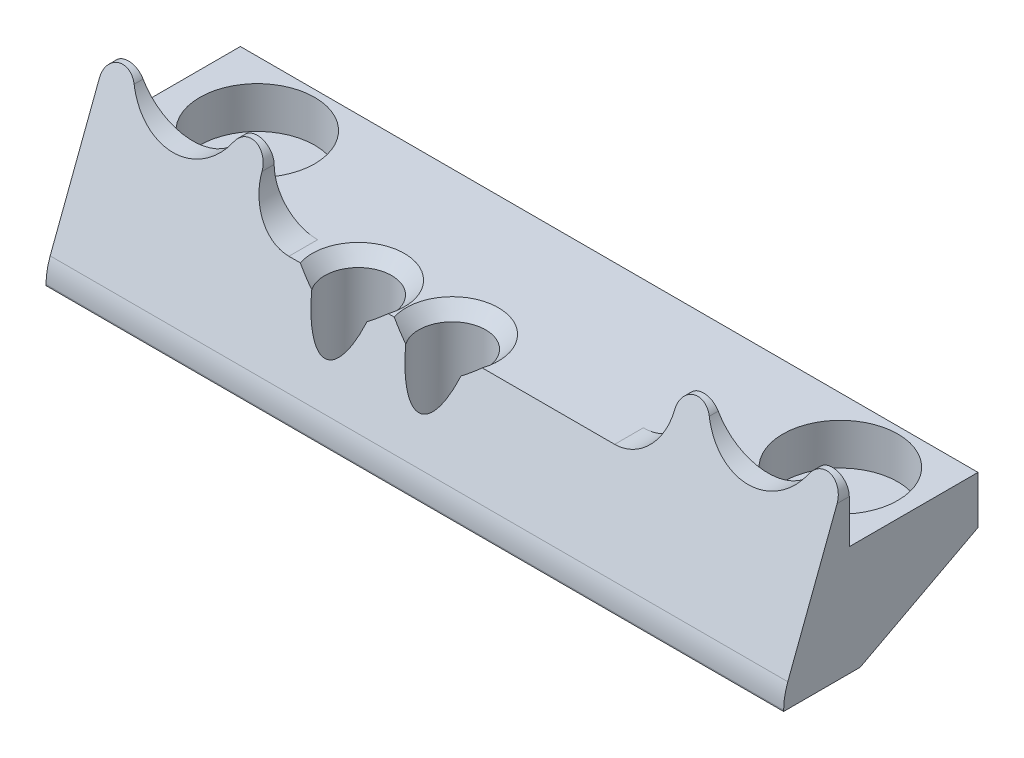
from build123d import *

# Parameters (mm, degrees)
SKETCH1_W               = 115.75
SKETCH1_H               = 30.5
SKETCH1_R               = 2.75
SKETCH1_R_2             = 9.025
BOSS_EXTRUDE1_DEPTH     = 17.25
SKETCH3_R               = 9.025
BOSS_EXTRUDE2_DEPTH     = 10.75
SKETCH4_R               = 5.25
CUT_EXTRUDE1_DEPTH      = 14.25
CUT_EXTRUDE2_DEPTH      = 120.171619944
CUT_EXTRUDE2_DEPTH_BACK = 120.171619944
BOSS_EXTRUDE4_REACH     = 67.617
CHAMFER1_SIZE           = 2


with BuildPart() as part:
    # Sketch1 → Boss-Extrude1 (new body)
    with BuildSketch(Plane(origin=(0, 0, 0), x_dir=(1, 0, 0), z_dir=(0, 1, 0))):
        with Locations((2.125, 7.25)):
            Rectangle(SKETCH1_W, SKETCH1_H)
        with Locations(Location((0, 0, 0), (0, 0, 270))):
            Circle(SKETCH1_R, mode=Mode.SUBTRACT)
        with Locations(Location((-14.75, 0, 0), (0, 0, 270))):
            Circle(SKETCH1_R, mode=Mode.SUBTRACT)
        with Locations(Location((48.5, 12.4, 0), (0, 0, 270))):
            Circle(SKETCH1_R_2, mode=Mode.SUBTRACT)
        with Locations(Location((-43, 12.4, 0), (0, 0, 270))):
            Circle(SKETCH1_R_2, mode=Mode.SUBTRACT)
    extrude(amount=BOSS_EXTRUDE1_DEPTH)

    # Sketch3 → Boss-Extrude2 (add)
    with BuildSketch(Plane.XZ):
        with Locations(Location((48.5, -12.4, 0), (0, 0, 270))):
            Circle(SKETCH3_R)
        with Locations(Location((-43, -12.4, 0), (0, 0, 270))):
            Circle(SKETCH3_R)
    extrude(amount=-BOSS_EXTRUDE2_DEPTH)

    # Sketch4 → Cut-Extrude1 (cut)
    with BuildSketch(Plane(origin=(0, 17.25, 0), x_dir=(1, 0, 0), z_dir=(0, 1, 0))):
        with Locations(Location((-14.75, 0, 0), (0, 0, 270))):
            Circle(SKETCH4_R)
        with Locations(Location((0, 0, 0), (0, 0, 270))):
            Circle(SKETCH4_R)
    extrude(amount=-CUT_EXTRUDE1_DEPTH, mode=Mode.SUBTRACT)

    # Sketch8 → Cut-Extrude2 (cut, two sides: drawn at the far end of the back side and taken through both)
    with BuildSketch(Plane(origin=(60, 0, 0), x_dir=(0, 0, -1), z_dir=(1, 0, 0)).offset(-CUT_EXTRUDE2_DEPTH_BACK)):
        with BuildLine():
            Line((-2.2, 17.25), (-7.34681784, 3.717418611))
            ThreePointArc((-7.34681784, 3.717418611), (-7.835348962, 1.969746414), (-8, 0.162563302))
            Line((-8, 0.162563302), (-8, 17.25))
            Line((-8, 17.25), (-2.2, 17.25))
        make_face()
        Polygon((22.5, 9.75), (4, 0), (22.5, 0), align=None)
    extrude(amount=CUT_EXTRUDE2_DEPTH + CUT_EXTRUDE2_DEPTH_BACK, mode=Mode.SUBTRACT)

    # Boss-Extrude4: up to this plane
    boss_extrude4_end = Plane(origin=(-55.75, 17.25, 2.2), z_dir=(0, -0.35548553095217983, -0.9346817839690934))
    # Sketch7 → Boss-Extrude4 (add, up to the surface)
    with BuildSketch(Plane.XY.offset(-2.3), mode=Mode.PRIVATE) as boss_extrude4_sk1:
        with BuildLine():
            ThreePointArc((39.434120731, 25.3875), (36.45982129, 26.619495167), (34.5, 24.065406335))
            ThreePointArc((34.5, 24.065406335), (32.503813701, 19.246186299), (27.684593665, 17.25))
            Line((27.684593665, 17.25), (60, 17.25))
            Line((60, 17.25), (60, 24.065406335))
            ThreePointArc((60, 24.065406335), (58.04017871, 26.619495167), (55.065879269, 25.3875))
            ThreePointArc((55.065879269, 25.3875), (47.25, 20.875), (39.434120731, 25.3875))
        make_face()
    boss_extrude4_tool1 = split(extrude(boss_extrude4_sk1.sketch, amount=BOSS_EXTRUDE4_REACH, mode=Mode.PRIVATE), bisect_by=boss_extrude4_end, keep=Keep.BOTH, mode=Mode.PRIVATE)
    add(boss_extrude4_tool1.solids().sort_by_distance((46.440425, 20.76167, -2.3))[0])
    # Sketch7 → Boss-Extrude4 (add, up to the surface)
    with BuildSketch(Plane.XY.offset(-2.3), mode=Mode.PRIVATE) as boss_extrude4_sk2:
        with BuildLine():
            ThreePointArc((-30.25, 24.065406335), (-28.253813701, 19.246186299), (-23.434593665, 17.25))
            Line((-23.434593665, 17.25), (-55.75, 17.25))
            Line((-55.75, 17.25), (-55.75, 24.065406335))
            ThreePointArc((-55.75, 24.065406335), (-53.79017871, 26.619495167), (-50.815879269, 25.3875))
            ThreePointArc((-50.815879269, 25.3875), (-43, 20.875), (-35.184120731, 25.3875))
            ThreePointArc((-35.184120731, 25.3875), (-32.20982129, 26.619495167), (-30.25, 24.065406335))
        make_face()
    boss_extrude4_tool2 = split(extrude(boss_extrude4_sk2.sketch, amount=BOSS_EXTRUDE4_REACH, mode=Mode.PRIVATE), bisect_by=boss_extrude4_end, keep=Keep.BOTH, mode=Mode.PRIVATE)
    add(boss_extrude4_tool2.solids().sort_by_distance((-42.190425, 20.76167, -2.3))[0])

    # Chamfer1
    chamfer1_edges = [part.edges().sort_by_distance(p)[0] for p in [
        (0, 17.25, -5.25),
        (-14.75, 17.25, -5.25),
    ]]
    chamfer(chamfer1_edges, length=CHAMFER1_SIZE)


solid = part.part
